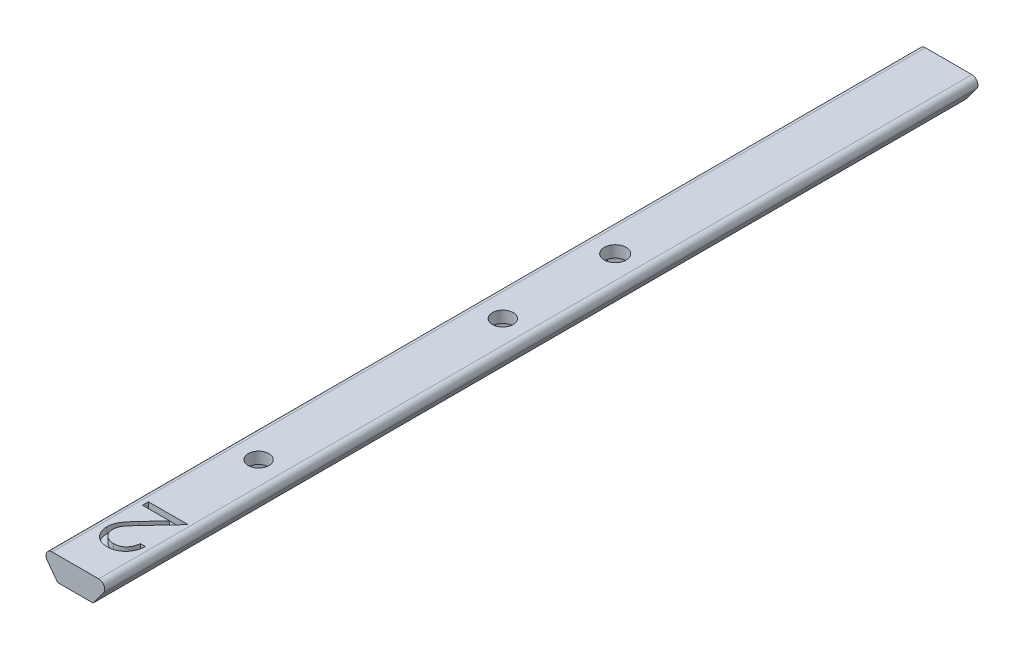
from build123d import *

# Parameters (mm, degrees)
BOSS_EXTRUDE1_DEPTH = 143
FILLET1_R           = 1
SKETCH2_R           = 1.8
CUT_EXTRUDE1_DEPTH  = 200
CUT_EXTRUDE2_DEPTH  = 2
CUT_EXTRUDE3_DEPTH  = 1
SKETCH5_R           = 1.7
CUT_EXTRUDE4_DEPTH  = 10
LPATTERN1_COUNT     = 2
LPATTERN1_PITCH     = 40
CUT_EXTRUDE5_DEPTH  = 2


with BuildPart() as part:
    # Sketch1 → Boss-Extrude1 (new body)
    with BuildSketch(Plane.XY):
        Polygon((0, 0), (5.8, 0), (8.7, 3.9), (-2.9, 3.9), align=None)
    extrude(amount=BOSS_EXTRUDE1_DEPTH)

    # Fillet1
    fillet1_edges = [part.edges().sort_by_distance(p)[0] for p in [
        (-2.9, 3.9, 71.5),
        (8.7, 3.9, 71.5),
    ]]
    fillet(fillet1_edges, radius=FILLET1_R)

    # Sketch2 → Cut-Extrude1 (cut)
    with BuildSketch(Plane.XZ):
        with Locations(Location((2.9, 54.6, 0), (0, 0, 270))):
            Circle(SKETCH2_R)
    extrude(amount=-CUT_EXTRUDE1_DEPTH, mode=Mode.SUBTRACT)

    # Sketch3 → Cut-Extrude2 (cut)
    with BuildSketch(Plane.XZ):
        Polygon((2.90000734, 57.948631561), (3.67e-06, 56.274322137), (-3.67e-06, 52.925690576), (2.89999266, 51.251368439), (5.79999633, 52.925677863), (5.80000367, 56.274309424), align=None)
    extrude(amount=-CUT_EXTRUDE2_DEPTH, mode=Mode.SUBTRACT)

    # Sketch4 → Cut-Extrude3 (cut)
    with BuildSketch(Plane(origin=(0, 3.9, 0), x_dir=(1, 0, 0), z_dir=(0, 1, 0))):
        with BuildLine():
            Line((5.122745858, -134.594230769), (5.977553551, -134.594230769))
            add(Edge.make_bspline(
                [(5.977553551, -134.594230769), (5.971983318, -134.707635673), (5.96104353, -134.930359885), (5.909790268, -135.255083464), (5.836521158, -135.565504079), (5.732681737, -135.858960447), (5.604449126, -136.138958148), (5.447455301, -136.401779138), (5.265047116, -136.650031883), (5.057559206, -136.879016136), (4.832415701, -137.088336373), (4.59096556, -137.271007952), (4.335690435, -137.423581719), (4.068804473, -137.551823488), (3.787221058, -137.647967628), (3.493631813, -137.719336337), (3.186709745, -137.762268246), (2.977595349, -137.766883522), (2.871243455, -137.769230769)],
                knots=[0, 0, 0, 0, 1.100776268, 2.161895295, 3.184016182, 4.190939212, 5.176500551, 6.166955529, 7.155448256, 8.160289653, 9.16017456, 10.133824356, 11.091467644, 12.04088621, 13.000931625, 13.972173743, 14.968683325, 16, 16, 16, 16], degree=3))
            add(Edge.make_bspline(
                [(2.871243455, -137.769230769), (2.766792917, -137.766805526), (2.561551342, -137.76204001), (2.26212941, -137.720499656), (1.976409076, -137.656842765), (1.707628406, -137.56251328), (1.453028956, -137.444150411), (1.215763088, -137.296950676), (0.990093468, -137.127879071), (0.787095567, -136.928450822), (0.600617505, -136.715660377), (0.43988469, -136.488401971), (0.301460326, -136.253409781), (0.188164307, -136.008848177), (0.102280887, -135.753920747), (0.038649503, -135.491071568), (0.002274366, -135.217267183), (-0.003277626, -135.031914725), (-0.006100295, -134.937680288)],
                knots=[0, 0, 0, 0, 1.111674182, 2.184400057, 3.212814286, 4.223731311, 5.211378316, 6.196328225, 7.191884489, 8.207283132, 9.220262353, 10.201199469, 11.166417575, 12.120932471, 13.06540007, 14.026332106, 14.996573967, 16, 16, 16, 16], degree=3))
            add(Edge.make_bspline(
                [(-0.006100295, -134.937680288), (-0.001492129, -134.805016596), (0.007643337, -134.54201727), (0.0857864, -134.155533128), (0.207837017, -133.781085653), (0.354773944, -133.479711723), (0.503045957, -133.236892134), (0.63652693, -133.036867771), (0.79367716, -132.821551985), (0.973154024, -132.590073288), (1.178048369, -132.345463088), (1.403037067, -132.082730681), (1.653930529, -131.806734169), (1.829867162, -131.618102024), (1.921033118, -131.520357572)],
                knots=[0, 0, 0, 0, 1.184416499, 2.348048165, 3.509039915, 4.696071444, 5.333504901, 6.05069495, 6.844171097, 7.714965912, 8.667477798, 9.695072654, 10.805644396, 12, 12, 12, 12], degree=3))
            Line((1.921033118, -131.520357572), (4.304191171, -128.976923077))
            Line((4.304191171, -128.976923077), (-0.12821568, -128.976923077))
            Line((-0.12821568, -128.976923077), (-0.12821568, -128))
            Line((-0.12821568, -128), (6.343899705, -128))
            Line((6.343899705, -128), (2.64990932, -131.94203726))
            add(Edge.make_bspline(
                [(2.64990932, -131.94203726), (2.559965489, -132.035916816), (2.387201798, -132.216240231), (2.142948702, -132.479586657), (1.923217267, -132.723609906), (1.727861736, -132.949391305), (1.55672137, -133.155650884), (1.410343741, -133.344005051), (1.288081888, -133.512837404), (1.158509801, -133.711174594), (1.034954218, -133.953619944), (0.926361503, -134.248410515), (0.860620951, -134.552545379), (0.85269448, -134.758008475), (0.848707397, -134.861358173)],
                knots=[0, 0, 0, 0, 1.329530082, 2.553755191, 3.672934919, 4.687409497, 5.60679272, 6.413407421, 7.126401618, 7.737995624, 8.834647426, 9.90044882, 10.943907757, 12, 12, 12, 12], degree=3))
            add(Edge.make_bspline(
                [(0.848707397, -134.861358173), (0.850419752, -134.926356875), (0.853794476, -135.054456835), (0.884142204, -135.242148032), (0.928729039, -135.423900083), (0.997451125, -135.597465755), (1.080018182, -135.766258747), (1.185503685, -135.925147228), (1.306045915, -136.079547323), (1.445868989, -136.224164782), (1.599368744, -136.356656831), (1.761555505, -136.474013435), (1.933140485, -136.572091957), (2.113408614, -136.652492299), (2.301855113, -136.715562491), (2.498845054, -136.759264755), (2.703833976, -136.786703519), (2.843806562, -136.790416014), (2.915128671, -136.792307692)],
                knots=[0, 0, 0, 0, 0.991504627, 1.954065223, 2.895985987, 3.842598665, 4.797835564, 5.759220273, 6.74786863, 7.784730864, 8.824135544, 9.839918996, 10.835834653, 11.835434876, 12.84861661, 13.863796685, 14.911511676, 16, 16, 16, 16], degree=3))
            add(Edge.make_bspline(
                [(2.915128671, -136.792307692), (2.989635464, -136.790439156), (3.135954505, -136.786769659), (3.350321609, -136.758957907), (3.556252164, -136.716838427), (3.750572839, -136.649784559), (3.937350419, -136.571306767), (4.111820115, -136.469691831), (4.278882998, -136.353581052), (4.435180219, -136.218203259), (4.577533213, -136.065382121), (4.707033005, -135.899039013), (4.816759463, -135.716225009), (4.914162533, -135.521326783), (4.988656651, -135.308989677), (5.052343784, -135.084406654), (5.098605194, -134.844373441), (5.11456532, -134.678996532), (5.122745858, -134.594230769)],
                knots=[0, 0, 0, 0, 1.031072318, 2.024855787, 2.988461151, 3.935103592, 4.865765533, 5.788564469, 6.724086513, 7.67908574, 8.64457978, 9.611397706, 10.591395687, 11.591555111, 12.622101007, 13.700900657, 14.821571223, 16, 16, 16, 16], degree=3))
        make_face()
    extrude(amount=-CUT_EXTRUDE3_DEPTH, mode=Mode.SUBTRACT)

    # Sketch5 → Cut-Extrude4 (cut)
    with BuildSketch(Plane(origin=(0, 3.9, 0), x_dir=(1, 0, 0), z_dir=(0, 1, 0))):
        with Locations(Location((2.9, -113, 0), (0, 0, 270))):
            Circle(SKETCH5_R)
    cut_extrude4 = extrude(amount=-CUT_EXTRUDE4_DEPTH, mode=Mode.SUBTRACT)

    # LPattern1: Cut-Extrude4 ×2
    with Locations(*[(0, 0, -i * LPATTERN1_PITCH) for i in range(1, LPATTERN1_COUNT)]):
        add(cut_extrude4, mode=Mode.SUBTRACT)

    # Sketch6 → Cut-Extrude5 (cut)
    with BuildSketch(Plane.XZ):
        Polygon((5.797077148, 114.679368135), (2.894163107, 116.348626474), (-0.002914041, 114.669258339), (0.002922852, 111.320631865), (2.905836893, 109.651373526), (5.802914041, 111.330741661), align=None)
        Polygon((5.797077148, 74.679368135), (2.894163107, 76.348626474), (-0.002914041, 74.669258339), (0.002922852, 71.320631865), (2.905836893, 69.651373526), (5.802914041, 71.330741661), align=None)
    extrude(amount=-CUT_EXTRUDE5_DEPTH, mode=Mode.SUBTRACT)


solid = part.part
